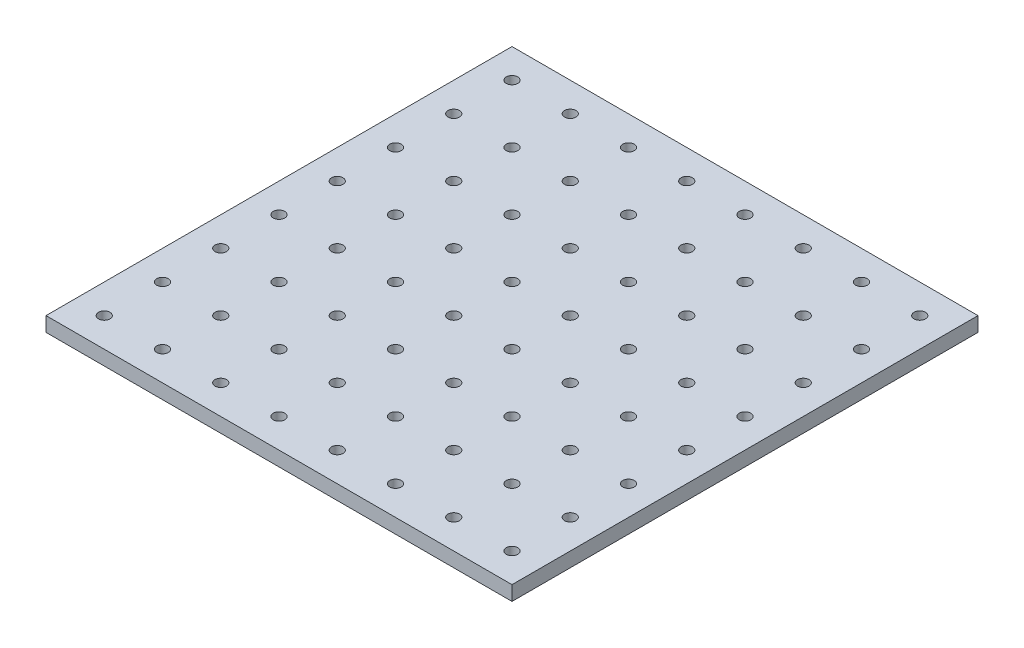
from build123d import *

# Parameters (mm, degrees)
SKETCH1_W           = 203.2
SKETCH1_H           = 203.2
SKETCH1_R           = 2.5
BOSS_EXTRUDE1_DEPTH = 6.35


with BuildPart() as part:
    # Sketch1 → Boss-Extrude1 (new body)
    with BuildSketch(Plane(origin=(0, 0, 0), x_dir=(1, 0, 0), z_dir=(0, 1, 0))):
        with Locations((-25.4, 25.4)):
            Rectangle(SKETCH1_W, SKETCH1_H)
        with Locations(Location((-114.3, 114.3, 0), (0, 0, 270))):
            Circle(SKETCH1_R, mode=Mode.SUBTRACT)
        with Locations(Location((-88.9, 114.3, 0), (0, 0, 270))):
            Circle(SKETCH1_R, mode=Mode.SUBTRACT)
        with Locations(Location((-63.5, 114.3, 0), (0, 0, 270))):
            Circle(SKETCH1_R, mode=Mode.SUBTRACT)
        with Locations(Location((-38.1, 114.3, 0), (0, 0, 270))):
            Circle(SKETCH1_R, mode=Mode.SUBTRACT)
        with Locations(Location((-12.7, 114.3, 0), (0, 0, 270))):
            Circle(SKETCH1_R, mode=Mode.SUBTRACT)
        with Locations(Location((12.7, 114.3, 0), (0, 0, 270))):
            Circle(SKETCH1_R, mode=Mode.SUBTRACT)
        with Locations(Location((38.1, 114.3, 0), (0, 0, 270))):
            Circle(SKETCH1_R, mode=Mode.SUBTRACT)
        with Locations(Location((63.5, 114.3, 0), (0, 0, 270))):
            Circle(SKETCH1_R, mode=Mode.SUBTRACT)
        with Locations(Location((-88.9, 88.9, 0), (0, 0, 270))):
            Circle(SKETCH1_R, mode=Mode.SUBTRACT)
        with Locations(Location((-63.5, 88.9, 0), (0, 0, 270))):
            Circle(SKETCH1_R, mode=Mode.SUBTRACT)
        with Locations(Location((-38.1, 88.9, 0), (0, 0, 270))):
            Circle(SKETCH1_R, mode=Mode.SUBTRACT)
        with Locations(Location((-12.7, 88.9, 0), (0, 0, 270))):
            Circle(SKETCH1_R, mode=Mode.SUBTRACT)
        with Locations(Location((12.7, 88.9, 0), (0, 0, 270))):
            Circle(SKETCH1_R, mode=Mode.SUBTRACT)
        with Locations(Location((38.1, 88.9, 0), (0, 0, 270))):
            Circle(SKETCH1_R, mode=Mode.SUBTRACT)
        with Locations(Location((63.5, 88.9, 0), (0, 0, 270))):
            Circle(SKETCH1_R, mode=Mode.SUBTRACT)
        with Locations(Location((-88.9, 63.5, 0), (0, 0, 270))):
            Circle(SKETCH1_R, mode=Mode.SUBTRACT)
        with Locations(Location((-63.5, 63.5, 0), (0, 0, 270))):
            Circle(SKETCH1_R, mode=Mode.SUBTRACT)
        with Locations(Location((-38.1, 63.5, 0), (0, 0, 270))):
            Circle(SKETCH1_R, mode=Mode.SUBTRACT)
        with Locations(Location((-12.7, 63.5, 0), (0, 0, 270))):
            Circle(SKETCH1_R, mode=Mode.SUBTRACT)
        with Locations(Location((12.7, 63.5, 0), (0, 0, 270))):
            Circle(SKETCH1_R, mode=Mode.SUBTRACT)
        with Locations(Location((38.1, 63.5, 0), (0, 0, 270))):
            Circle(SKETCH1_R, mode=Mode.SUBTRACT)
        with Locations(Location((63.5, 63.5, 0), (0, 0, 270))):
            Circle(SKETCH1_R, mode=Mode.SUBTRACT)
        with Locations(Location((-88.9, 38.1, 0), (0, 0, 270))):
            Circle(SKETCH1_R, mode=Mode.SUBTRACT)
        with Locations(Location((-63.5, 38.1, 0), (0, 0, 270))):
            Circle(SKETCH1_R, mode=Mode.SUBTRACT)
        with Locations(Location((-38.1, 38.1, 0), (0, 0, 270))):
            Circle(SKETCH1_R, mode=Mode.SUBTRACT)
        with Locations(Location((-12.7, 38.1, 0), (0, 0, 270))):
            Circle(SKETCH1_R, mode=Mode.SUBTRACT)
        with Locations(Location((12.7, 38.1, 0), (0, 0, 270))):
            Circle(SKETCH1_R, mode=Mode.SUBTRACT)
        with Locations(Location((38.1, 38.1, 0), (0, 0, 270))):
            Circle(SKETCH1_R, mode=Mode.SUBTRACT)
        with Locations(Location((63.5, 38.1, 0), (0, 0, 270))):
            Circle(SKETCH1_R, mode=Mode.SUBTRACT)
        with Locations(Location((-88.9, 12.7, 0), (0, 0, 270))):
            Circle(SKETCH1_R, mode=Mode.SUBTRACT)
        with Locations(Location((-63.5, 12.7, 0), (0, 0, 270))):
            Circle(SKETCH1_R, mode=Mode.SUBTRACT)
        with Locations(Location((-38.1, 12.7, 0), (0, 0, 270))):
            Circle(SKETCH1_R, mode=Mode.SUBTRACT)
        with Locations(Location((-12.7, 12.7, 0), (0, 0, 270))):
            Circle(SKETCH1_R, mode=Mode.SUBTRACT)
        with Locations(Location((12.7, 12.7, 0), (0, 0, 270))):
            Circle(SKETCH1_R, mode=Mode.SUBTRACT)
        with Locations(Location((38.1, 12.7, 0), (0, 0, 270))):
            Circle(SKETCH1_R, mode=Mode.SUBTRACT)
        with Locations(Location((63.5, 12.7, 0), (0, 0, 270))):
            Circle(SKETCH1_R, mode=Mode.SUBTRACT)
        with Locations(Location((-88.9, -12.7, 0), (0, 0, 270))):
            Circle(SKETCH1_R, mode=Mode.SUBTRACT)
        with Locations(Location((-63.5, -12.7, 0), (0, 0, 270))):
            Circle(SKETCH1_R, mode=Mode.SUBTRACT)
        with Locations(Location((-38.1, -12.7, 0), (0, 0, 270))):
            Circle(SKETCH1_R, mode=Mode.SUBTRACT)
        with Locations(Location((-12.7, -12.7, 0), (0, 0, 270))):
            Circle(SKETCH1_R, mode=Mode.SUBTRACT)
        with Locations(Location((12.7, -12.7, 0), (0, 0, 270))):
            Circle(SKETCH1_R, mode=Mode.SUBTRACT)
        with Locations(Location((38.1, -12.7, 0), (0, 0, 270))):
            Circle(SKETCH1_R, mode=Mode.SUBTRACT)
        with Locations(Location((63.5, -12.7, 0), (0, 0, 270))):
            Circle(SKETCH1_R, mode=Mode.SUBTRACT)
        with Locations(Location((-88.9, -38.1, 0), (0, 0, 270))):
            Circle(SKETCH1_R, mode=Mode.SUBTRACT)
        with Locations(Location((-63.5, -38.1, 0), (0, 0, 270))):
            Circle(SKETCH1_R, mode=Mode.SUBTRACT)
        with Locations(Location((-38.1, -38.1, 0), (0, 0, 270))):
            Circle(SKETCH1_R, mode=Mode.SUBTRACT)
        with Locations(Location((-12.7, -38.1, 0), (0, 0, 270))):
            Circle(SKETCH1_R, mode=Mode.SUBTRACT)
        with Locations(Location((12.7, -38.1, 0), (0, 0, 270))):
            Circle(SKETCH1_R, mode=Mode.SUBTRACT)
        with Locations(Location((38.1, -38.1, 0), (0, 0, 270))):
            Circle(SKETCH1_R, mode=Mode.SUBTRACT)
        with Locations(Location((63.5, -38.1, 0), (0, 0, 270))):
            Circle(SKETCH1_R, mode=Mode.SUBTRACT)
        with Locations(Location((-88.9, -63.5, 0), (0, 0, 270))):
            Circle(SKETCH1_R, mode=Mode.SUBTRACT)
        with Locations(Location((-63.5, -63.5, 0), (0, 0, 270))):
            Circle(SKETCH1_R, mode=Mode.SUBTRACT)
        with Locations(Location((-38.1, -63.5, 0), (0, 0, 270))):
            Circle(SKETCH1_R, mode=Mode.SUBTRACT)
        with Locations(Location((-12.7, -63.5, 0), (0, 0, 270))):
            Circle(SKETCH1_R, mode=Mode.SUBTRACT)
        with Locations(Location((12.7, -63.5, 0), (0, 0, 270))):
            Circle(SKETCH1_R, mode=Mode.SUBTRACT)
        with Locations(Location((38.1, -63.5, 0), (0, 0, 270))):
            Circle(SKETCH1_R, mode=Mode.SUBTRACT)
        with Locations(Location((63.5, -63.5, 0), (0, 0, 270))):
            Circle(SKETCH1_R, mode=Mode.SUBTRACT)
        with Locations(Location((-114.3, 88.9, 0), (0, 0, 270))):
            Circle(SKETCH1_R, mode=Mode.SUBTRACT)
        with Locations(Location((-114.3, 63.5, 0), (0, 0, 270))):
            Circle(SKETCH1_R, mode=Mode.SUBTRACT)
        with Locations(Location((-114.3, 38.1, 0), (0, 0, 270))):
            Circle(SKETCH1_R, mode=Mode.SUBTRACT)
        with Locations(Location((-114.3, 12.7, 0), (0, 0, 270))):
            Circle(SKETCH1_R, mode=Mode.SUBTRACT)
        with Locations(Location((-114.3, -12.7, 0), (0, 0, 270))):
            Circle(SKETCH1_R, mode=Mode.SUBTRACT)
        with Locations(Location((-114.3, -38.1, 0), (0, 0, 270))):
            Circle(SKETCH1_R, mode=Mode.SUBTRACT)
        with Locations(Location((-114.3, -63.5, 0), (0, 0, 270))):
            Circle(SKETCH1_R, mode=Mode.SUBTRACT)
    extrude(amount=BOSS_EXTRUDE1_DEPTH)


solid = part.part
